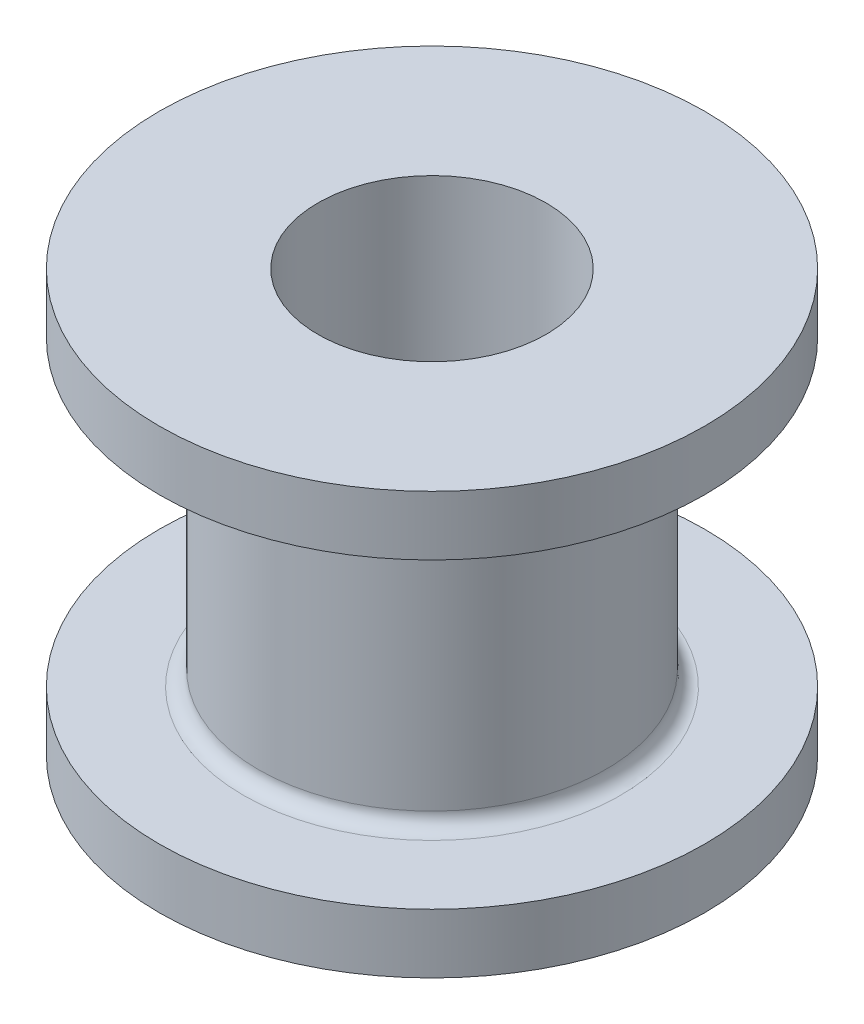
from build123d import *

# Parameters (mm, degrees)
FILLET1_R = 3


with BuildPart() as part:
    # Sketch1 → Revolve1 (revolve)
    with BuildSketch(Plane.XY, mode=Mode.PRIVATE) as revolve1_sk:
        Polygon((23, 85), (55, 85), (55, 73), (35, 73), (35, 12), (55, 12), (55, 0), (23, 0), align=None)
    revolve(revolve1_sk.sketch.rotate(Axis((0, 0, 0), (0, 1, 0)), 90), axis=Axis((0, 0, 0), (0, 1, 0)))

    # Fillet1
    fillet1_edges = [part.edges().sort_by_distance(p)[0] for p in [
        (0, 12, 35),
        (0, 73, 35),
    ]]
    fillet(fillet1_edges, radius=FILLET1_R)


solid = part.part
